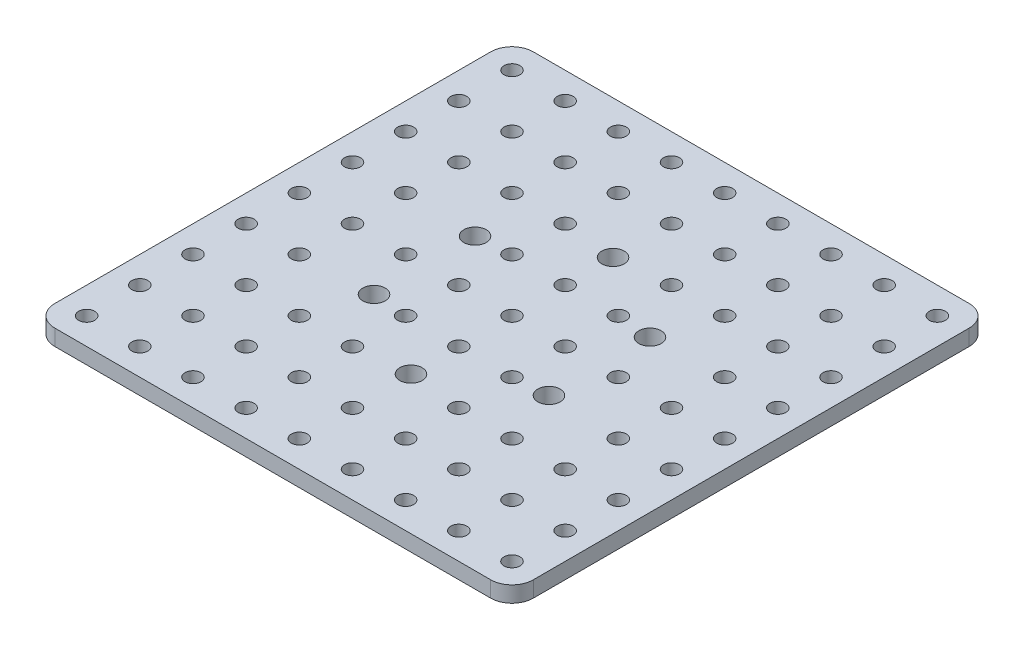
from build123d import *

# Parameters (mm, degrees)
SKETCH_1_W          = 90
SKETCH_1_H          = 90
EXTRUDE_1_DEPTH     = 3
SKETCH_2_R          = 1.5
CUT_EXTRUDE_1_DEPTH = 64.710281745
SKETCH_3_R          = 1.5
CUT_EXTRUDE_2_DEPTH = 64.710281745
SKETCH_5_R          = 1.5
CUT_EXTRUDE_3_DEPTH = 64.710281745
FILLET_1_R          = 4
SKETCH_6_R          = 2.1
CUT_EXTRUDE_5_DEPTH = 64.710281745


with BuildPart() as part:
    # 草图1 → 凸台-拉伸1 (new body)
    with BuildSketch(Plane(origin=(0, 0, 0), x_dir=(1, 0, 0), z_dir=(0, 1, 0))):
        Rectangle(SKETCH_1_W, SKETCH_1_H)
    extrude(amount=EXTRUDE_1_DEPTH)

    # 草图2 → 切除-拉伸1 (cut, through all)
    with BuildSketch(Plane(origin=(0, 3, 0), x_dir=(1, 0, 0), z_dir=(0, 1, 0))):
        with Locations(Location((-40, 40, 0), (0, 0, 270))):
            Circle(SKETCH_2_R)
        with Locations(Location((40, 40, 0), (0, 0, 270))):
            Circle(SKETCH_2_R)
        with Locations(Location((40, -40, 0), (0, 0, 270))):
            Circle(SKETCH_2_R)
        with Locations(Location((-40, -40, 0), (0, 0, 270))):
            Circle(SKETCH_2_R)
    extrude(amount=-CUT_EXTRUDE_1_DEPTH, mode=Mode.SUBTRACT)

    # 草图3 → 切除-拉伸2 (cut, through all)
    with BuildSketch(Plane(origin=(0, 3, 0), x_dir=(1, 0, 0), z_dir=(0, 1, 0))):
        with Locations(Location((0, 0, 0), (0, 0, 270))):
            Circle(SKETCH_3_R)
        with Locations(Location((10, 0, 0), (0, 0, 270))):
            Circle(SKETCH_3_R)
        with Locations(Location((20, 0, 0), (0, 0, 270))):
            Circle(SKETCH_3_R)
        with Locations(Location((30, 0, 0), (0, 0, 270))):
            Circle(SKETCH_3_R)
        with Locations(Location((40, 0, 0), (0, 0, 270))):
            Circle(SKETCH_3_R)
        with Locations(Location((10, 10, 0), (0, 0, 270))):
            Circle(SKETCH_3_R)
        with Locations(Location((30, 10, 0), (0, 0, 270))):
            Circle(SKETCH_3_R)
        with Locations(Location((40, 10, 0), (0, 0, 270))):
            Circle(SKETCH_3_R)
        with Locations(Location((10, 20, 0), (0, 0, 270))):
            Circle(SKETCH_3_R)
        with Locations(Location((20, 20, 0), (0, 0, 270))):
            Circle(SKETCH_3_R)
        with Locations(Location((30, 20, 0), (0, 0, 270))):
            Circle(SKETCH_3_R)
        with Locations(Location((40, 20, 0), (0, 0, 270))):
            Circle(SKETCH_3_R)
        with Locations(Location((10, 30, 0), (0, 0, 270))):
            Circle(SKETCH_3_R)
        with Locations(Location((20, 30, 0), (0, 0, 270))):
            Circle(SKETCH_3_R)
        with Locations(Location((30, 30, 0), (0, 0, 270))):
            Circle(SKETCH_3_R)
        with Locations(Location((40, 30, 0), (0, 0, 270))):
            Circle(SKETCH_3_R)
        with Locations(Location((10, 40, 0), (0, 0, 270))):
            Circle(SKETCH_3_R)
        with Locations(Location((20, 40, 0), (0, 0, 270))):
            Circle(SKETCH_3_R)
        with Locations(Location((30, 40, 0), (0, 0, 270))):
            Circle(SKETCH_3_R)
        with Locations(Location((40, 40, 0), (0, 0, 270))):
            Circle(SKETCH_3_R)
        with Locations(Location((0, 10, 0), (0, 0, 270))):
            Circle(SKETCH_3_R)
        with Locations(Location((0, 30, 0), (0, 0, 270))):
            Circle(SKETCH_3_R)
        with Locations(Location((0, 40, 0), (0, 0, 270))):
            Circle(SKETCH_3_R)
        with Locations(Location((-10, 0, 0), (0, 0, 270))):
            Circle(SKETCH_3_R)
        with Locations(Location((-20, 0, 0), (0, 0, 270))):
            Circle(SKETCH_3_R)
        with Locations(Location((-30, 0, 0), (0, 0, 270))):
            Circle(SKETCH_3_R)
        with Locations(Location((-40, 0, 0), (0, 0, 270))):
            Circle(SKETCH_3_R)
        with Locations(Location((-10, -10, 0), (0, 0, 270))):
            Circle(SKETCH_3_R)
        with Locations(Location((-30, -10, 0), (0, 0, 270))):
            Circle(SKETCH_3_R)
        with Locations(Location((-40, -10, 0), (0, 0, 270))):
            Circle(SKETCH_3_R)
        with Locations(Location((-10, -20, 0), (0, 0, 270))):
            Circle(SKETCH_3_R)
        with Locations(Location((-20, -20, 0), (0, 0, 270))):
            Circle(SKETCH_3_R)
        with Locations(Location((-30, -20, 0), (0, 0, 270))):
            Circle(SKETCH_3_R)
        with Locations(Location((-40, -20, 0), (0, 0, 270))):
            Circle(SKETCH_3_R)
        with Locations(Location((-10, -30, 0), (0, 0, 270))):
            Circle(SKETCH_3_R)
        with Locations(Location((-20, -30, 0), (0, 0, 270))):
            Circle(SKETCH_3_R)
        with Locations(Location((-30, -30, 0), (0, 0, 270))):
            Circle(SKETCH_3_R)
        with Locations(Location((-40, -30, 0), (0, 0, 270))):
            Circle(SKETCH_3_R)
        with Locations(Location((-10, -40, 0), (0, 0, 270))):
            Circle(SKETCH_3_R)
        with Locations(Location((-20, -40, 0), (0, 0, 270))):
            Circle(SKETCH_3_R)
        with Locations(Location((-30, -40, 0), (0, 0, 270))):
            Circle(SKETCH_3_R)
        with Locations(Location((-40, -40, 0), (0, 0, 270))):
            Circle(SKETCH_3_R)
        with Locations(Location((0, -10, 0), (0, 0, 270))):
            Circle(SKETCH_3_R)
        with Locations(Location((0, -30, 0), (0, 0, 270))):
            Circle(SKETCH_3_R)
        with Locations(Location((0, -40, 0), (0, 0, 270))):
            Circle(SKETCH_3_R)
    extrude(amount=-CUT_EXTRUDE_2_DEPTH, mode=Mode.SUBTRACT)

    # 草图5 → 切除-拉伸3 (cut, through all)
    with BuildSketch(Plane(origin=(0, 3, 0), x_dir=(1, 0, 0), z_dir=(0, 1, 0))):
        with Locations(Location((0, 0, 0), (0, 0, 270))):
            Circle(SKETCH_5_R)
        with Locations(Location((-10, 0, 0), (0, 0, 270))):
            Circle(SKETCH_5_R)
        with Locations(Location((-20, 0, 0), (0, 0, 270))):
            Circle(SKETCH_5_R)
        with Locations(Location((-30, 0, 0), (0, 0, 270))):
            Circle(SKETCH_5_R)
        with Locations(Location((-40, 0, 0), (0, 0, 270))):
            Circle(SKETCH_5_R)
        with Locations(Location((-10, 10, 0), (0, 0, 270))):
            Circle(SKETCH_5_R)
        with Locations(Location((-30, 10, 0), (0, 0, 270))):
            Circle(SKETCH_5_R)
        with Locations(Location((-40, 10, 0), (0, 0, 270))):
            Circle(SKETCH_5_R)
        with Locations(Location((-10, 20, 0), (0, 0, 270))):
            Circle(SKETCH_5_R)
        with Locations(Location((-20, 20, 0), (0, 0, 270))):
            Circle(SKETCH_5_R)
        with Locations(Location((-30, 20, 0), (0, 0, 270))):
            Circle(SKETCH_5_R)
        with Locations(Location((-40, 20, 0), (0, 0, 270))):
            Circle(SKETCH_5_R)
        with Locations(Location((-10, 30, 0), (0, 0, 270))):
            Circle(SKETCH_5_R)
        with Locations(Location((-20, 30, 0), (0, 0, 270))):
            Circle(SKETCH_5_R)
        with Locations(Location((-30, 30, 0), (0, 0, 270))):
            Circle(SKETCH_5_R)
        with Locations(Location((-40, 30, 0), (0, 0, 270))):
            Circle(SKETCH_5_R)
        with Locations(Location((-10, 40, 0), (0, 0, 270))):
            Circle(SKETCH_5_R)
        with Locations(Location((-20, 40, 0), (0, 0, 270))):
            Circle(SKETCH_5_R)
        with Locations(Location((-30, 40, 0), (0, 0, 270))):
            Circle(SKETCH_5_R)
        with Locations(Location((-40, 40, 0), (0, 0, 270))):
            Circle(SKETCH_5_R)
        with Locations(Location((0, 10, 0), (0, 0, 270))):
            Circle(SKETCH_5_R)
        with Locations(Location((0, 30, 0), (0, 0, 270))):
            Circle(SKETCH_5_R)
        with Locations(Location((0, 40, 0), (0, 0, 270))):
            Circle(SKETCH_5_R)
        with Locations(Location((10, 0, 0), (0, 0, 270))):
            Circle(SKETCH_5_R)
        with Locations(Location((20, 0, 0), (0, 0, 270))):
            Circle(SKETCH_5_R)
        with Locations(Location((30, 0, 0), (0, 0, 270))):
            Circle(SKETCH_5_R)
        with Locations(Location((40, 0, 0), (0, 0, 270))):
            Circle(SKETCH_5_R)
        with Locations(Location((10, -10, 0), (0, 0, 270))):
            Circle(SKETCH_5_R)
        with Locations(Location((30, -10, 0), (0, 0, 270))):
            Circle(SKETCH_5_R)
        with Locations(Location((40, -10, 0), (0, 0, 270))):
            Circle(SKETCH_5_R)
        with Locations(Location((10, -20, 0), (0, 0, 270))):
            Circle(SKETCH_5_R)
        with Locations(Location((20, -20, 0), (0, 0, 270))):
            Circle(SKETCH_5_R)
        with Locations(Location((30, -20, 0), (0, 0, 270))):
            Circle(SKETCH_5_R)
        with Locations(Location((40, -20, 0), (0, 0, 270))):
            Circle(SKETCH_5_R)
        with Locations(Location((10, -30, 0), (0, 0, 270))):
            Circle(SKETCH_5_R)
        with Locations(Location((20, -30, 0), (0, 0, 270))):
            Circle(SKETCH_5_R)
        with Locations(Location((30, -30, 0), (0, 0, 270))):
            Circle(SKETCH_5_R)
        with Locations(Location((40, -30, 0), (0, 0, 270))):
            Circle(SKETCH_5_R)
        with Locations(Location((10, -40, 0), (0, 0, 270))):
            Circle(SKETCH_5_R)
        with Locations(Location((20, -40, 0), (0, 0, 270))):
            Circle(SKETCH_5_R)
        with Locations(Location((30, -40, 0), (0, 0, 270))):
            Circle(SKETCH_5_R)
        with Locations(Location((40, -40, 0), (0, 0, 270))):
            Circle(SKETCH_5_R)
        with Locations(Location((0, -10, 0), (0, 0, 270))):
            Circle(SKETCH_5_R)
        with Locations(Location((0, -30, 0), (0, 0, 270))):
            Circle(SKETCH_5_R)
        with Locations(Location((0, -40, 0), (0, 0, 270))):
            Circle(SKETCH_5_R)
    extrude(amount=-CUT_EXTRUDE_3_DEPTH, mode=Mode.SUBTRACT)

    # 圆角1
    fillet_1_edges = [part.edges().sort_by_distance(p)[0] for p in [
        (45, 1.5, 45),
        (-45, 1.5, 45),
        (-45, 1.5, -45),
        (45, 1.5, -45),
    ]]
    fillet(fillet_1_edges, radius=FILLET_1_R)

    # 草图6 → 切除-拉伸5 (cut, through all)
    with BuildSketch(Plane(origin=(0, 3, 0), x_dir=(1, 0, 0), z_dir=(0, 1, 0))):
        with Locations(Location((0, 19, 0), (0, 0, 270))):
            Circle(SKETCH_6_R)
        with Locations(Location((16.454482672, 9.5, 0), (0, 0, 270))):
            Circle(SKETCH_6_R)
        with Locations(Location((16.454482672, -9.5, 0), (0, 0, 270))):
            Circle(SKETCH_6_R)
        with Locations(Location((0, -19, 0), (0, 0, 270))):
            Circle(SKETCH_6_R)
        with Locations(Location((-16.454482672, -9.5, 0), (0, 0, 270))):
            Circle(SKETCH_6_R)
        with Locations(Location((-16.454482672, 9.5, 0), (0, 0, 270))):
            Circle(SKETCH_6_R)
    extrude(amount=-CUT_EXTRUDE_5_DEPTH, mode=Mode.SUBTRACT)


solid = part.part
